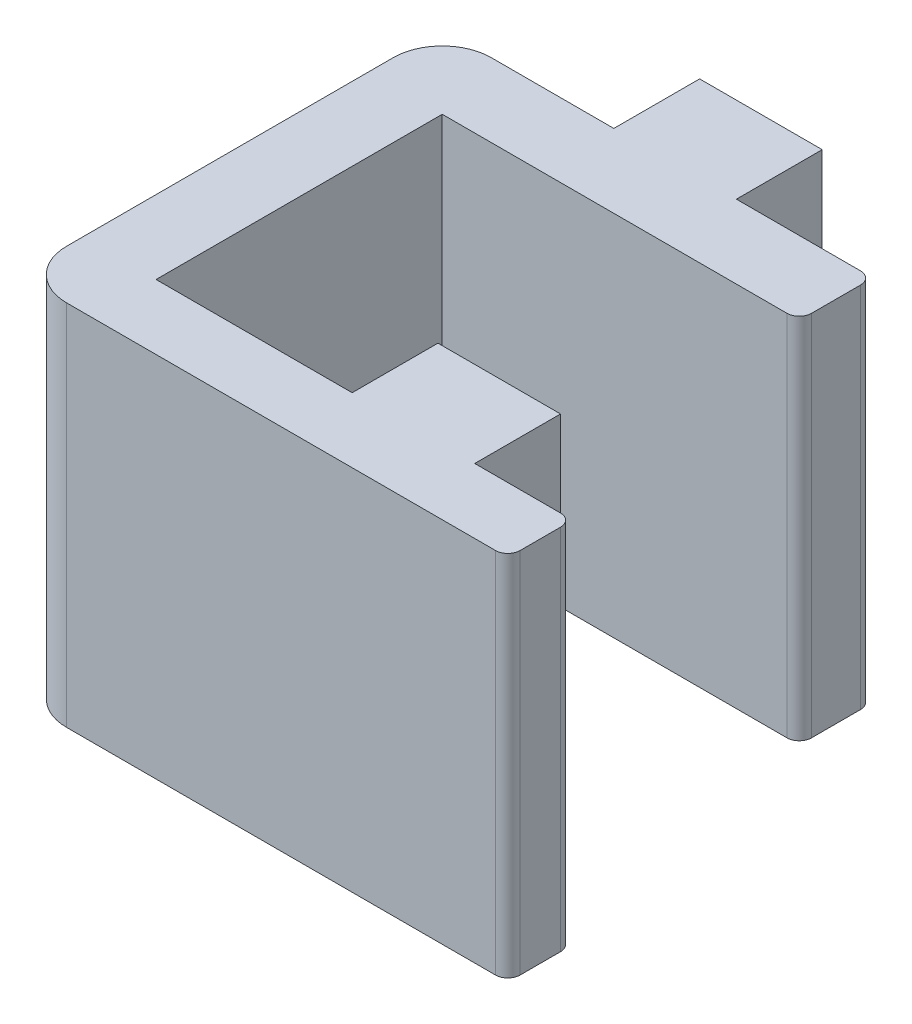
from build123d import *

# Parameters (mm, degrees)
BOSS_EXTRUDE1_DEPTH = 15
SKETCH2_W           = 5
SKETCH2_H           = 15
BOSS_EXTRUDE2_DEPTH = 3.5
SKETCH3_W           = 5
SKETCH3_H           = 15
BOSS_EXTRUDE3_DEPTH = 3.5
FILLET1_R           = 2
FILLET2_R           = 0.5


with BuildPart() as part:
    # Sketch1 → Boss-Extrude1 (new body)
    with BuildSketch(Plane(origin=(0, 0, 0), x_dir=(1, 0, 0), z_dir=(0, 1, 0))):
        Polygon((0, 0), (-20, 0), (-20, 17.325), (-2.435474502, 17.325), (-2.435474502, 14.325), (-17, 14.325), (-17, 2.65), (0, 2.65), align=None)
    extrude(amount=BOSS_EXTRUDE1_DEPTH)

    # Sketch2 → Boss-Extrude2 (add)
    with BuildSketch(Plane(origin=(0, 0, -2.65), x_dir=(-1, 0, 0), z_dir=(0, 0, -1))):
        with Locations((6.5, 7.5)):
            Rectangle(SKETCH2_W, SKETCH2_H)
    extrude(amount=BOSS_EXTRUDE2_DEPTH)

    # Sketch3 → Boss-Extrude3 (add)
    with BuildSketch(Plane(origin=(0, 0, -17.325), x_dir=(-1, 0, 0), z_dir=(0, 0, -1))):
        with Locations((10.5, 7.5)):
            Rectangle(SKETCH3_W, SKETCH3_H)
    extrude(amount=BOSS_EXTRUDE3_DEPTH)

    # Fillet1
    fillet1_edges = [part.edges().sort_by_distance(p)[0] for p in [
        (-20, 7.5, 0),
        (-20, 7.5, -17.325),
    ]]
    fillet(fillet1_edges, radius=FILLET1_R)

    # Fillet2
    fillet2_edges = [part.edges().sort_by_distance(p)[0] for p in [
        (0, 7.5, 0),
        (-2.435474502, 7.5, -17.325),
        (-2.435474502, 7.5, -14.325),
        (0, 7.5, -2.65),
    ]]
    fillet(fillet2_edges, radius=FILLET2_R)


solid = part.part
